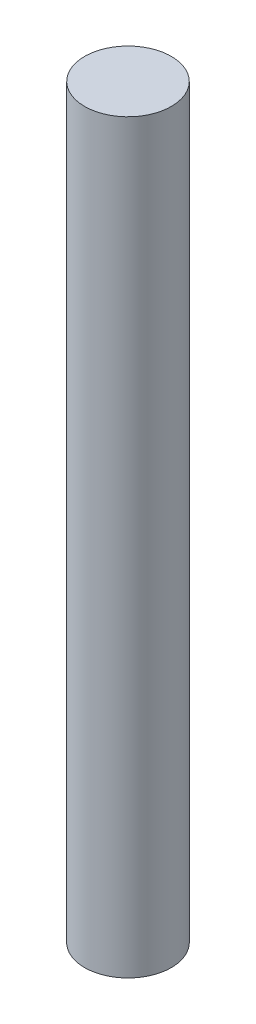
from build123d import *

# Parameters (mm, degrees)
SKETCH1_R           = 2.5
BOSS_EXTRUDE1_DEPTH = 43


with BuildPart() as part:
    # Sketch1 → Boss-Extrude1 (new body)
    with BuildSketch(Plane(origin=(0, 0, 0), x_dir=(1, 0, 0), z_dir=(0, 1, 0))):
        with Locations(Location((0, 0, 0), (0, 0, 270))):
            Circle(SKETCH1_R)
    extrude(amount=BOSS_EXTRUDE1_DEPTH)


solid = part.part
